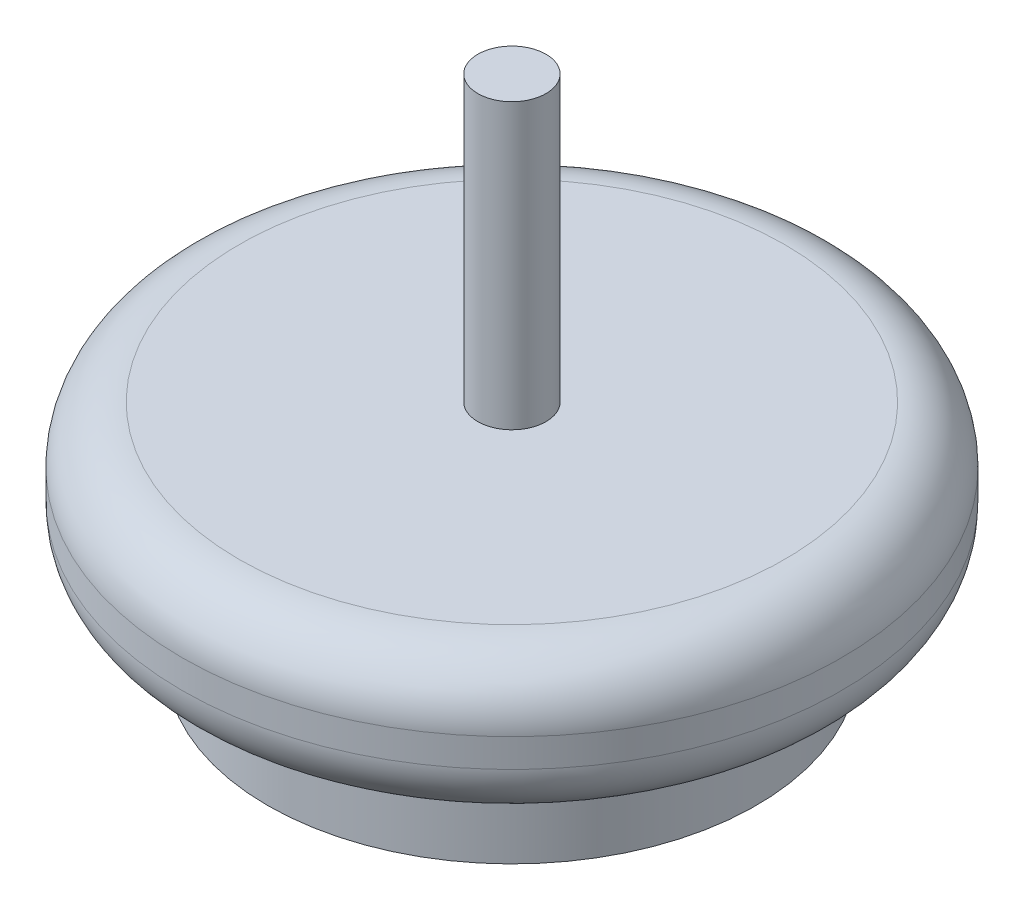
from build123d import *

# Parameters (mm, degrees)
SKETCH1_R           = 58
BOSS_EXTRUDE1_DEPTH = 25
SKETCH2_R           = 43
BOSS_EXTRUDE2_DEPTH = 15
FILLET1_R           = 10
BOSS_EXTRUDE3_START = 25
SKETCH3_R           = 6
BOSS_EXTRUDE3_DEPTH = 50


with BuildPart() as part:
    # Sketch1 → Boss-Extrude1 (new body)
    with BuildSketch(Plane(origin=(0, 0, 0), x_dir=(1, 0, 0), z_dir=(0, 1, 0))):
        with Locations(Location((0, 0, 0), (0, 0, 270))):
            Circle(SKETCH1_R)
    extrude(amount=BOSS_EXTRUDE1_DEPTH)

    # Sketch2 → Boss-Extrude2 (add)
    with BuildSketch(Plane(origin=(0, 0, 0), x_dir=(1, 0, 0), z_dir=(0, 1, 0))):
        with Locations(Location((0, 0, 0), (0, 0, 270))):
            Circle(SKETCH2_R)
    extrude(amount=-BOSS_EXTRUDE2_DEPTH)

    # Fillet1
    fillet1_edges = [part.edges().sort_by_distance(p)[0] for p in [
        (0, 0, -58),
        (0, 25, -58),
    ]]
    fillet(fillet1_edges, radius=FILLET1_R)

    # Sketch3 → Boss-Extrude3 (add)
    with BuildSketch(Plane(origin=(0, 0, 0), x_dir=(1, 0, 0), z_dir=(0, 1, 0)).offset(BOSS_EXTRUDE3_START)):
        with Locations(Location((0, 0, 0), (0, 0, 270))):
            Circle(SKETCH3_R)
    extrude(amount=BOSS_EXTRUDE3_DEPTH)


solid = part.part
